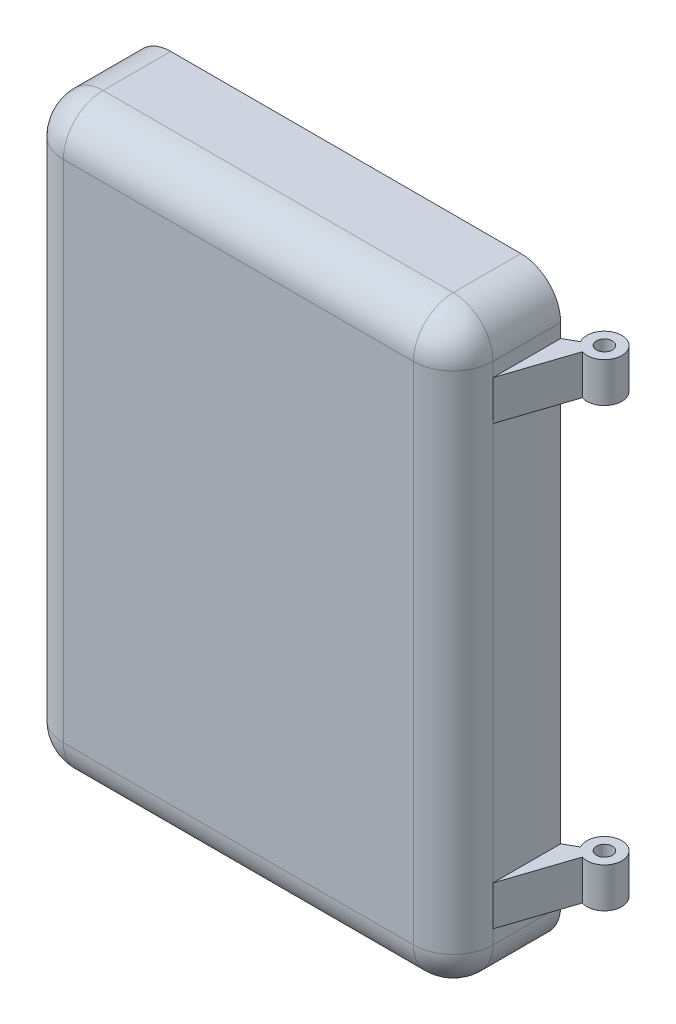
from build123d import *

# Parameters (mm, degrees)
FILLET1_R           = 10
SHELL1_T            = -2.7
SKETCH4_R           = 2
BOSS_EXTRUDE1_DEPTH = 10


with BuildPart() as part:
    # Sketch2 → Loft1 section 0
    with BuildSketch(Plane.XY.offset(27)):
        with BuildLine():
            Line((-54, 73.5), (54, 73.5))
            Line((54, 73.5), (54, -73.5))
            Line((54, -73.5), (-54, -73.5))
            Line((-54, -73.5), (-54, 73.5))
        make_face()
    # Sketch1 → Loft1 section 1
    with BuildSketch(Plane.XY):
        with BuildLine():
            Line((54, 73.5), (-54, 73.5))
            Line((-54, 73.5), (-54, -73.5))
            Line((-54, -73.5), (54, -73.5))
            Line((54, -73.5), (54, 73.5))
        make_face()
    loft()

    # Fillet1
    fillet1_edges = [part.edges().sort_by_distance(p)[0] for p in [
        (0, -73.5, 27),
        (-54, 0, 27),
        (0, 73.5, 27),
        (54, 0, 27),
        (54, 73.5, 13.5),
        (-54, 73.5, 13.5),
        (-54, -73.5, 13.5),
        (54, -73.5, 13.5),
    ]]
    fillet(fillet1_edges, radius=FILLET1_R)

    # Shell1
    shell1_openings = [part.faces().sort_by_distance(p)[0] for p in [
        (9.6e-08, -7.1e-08, 0),
    ]]
    offset(amount=SHELL1_T, openings=shell1_openings)

    # Sketch4 → Boss-Extrude1 (add)
    with BuildSketch(Plane(origin=(0, 50, 0), x_dir=(1, 0, 0), z_dir=(0, 1, 0))):
        with BuildLine():
            Line((57.194341554, 1.825338031), (54, 0))
            Line((54, 0), (54, -17))
            Line((54, -17), (59.613919523, -0.158241431))
            ThreePointArc((59.613919523, -0.158241431), (63.778881993, 7.3896911), (57.194341554, 1.825338031))
        make_face()
        with Locations(Location((61, 4, 0), (0, 0, 270))):
            Circle(SKETCH4_R, mode=Mode.SUBTRACT)
    boss_extrude1 = extrude(amount=BOSS_EXTRUDE1_DEPTH)

    # Mirror1: Boss-Extrude1 across plane
    add(boss_extrude1.mirror(Plane.ZX))


solid = part.part
